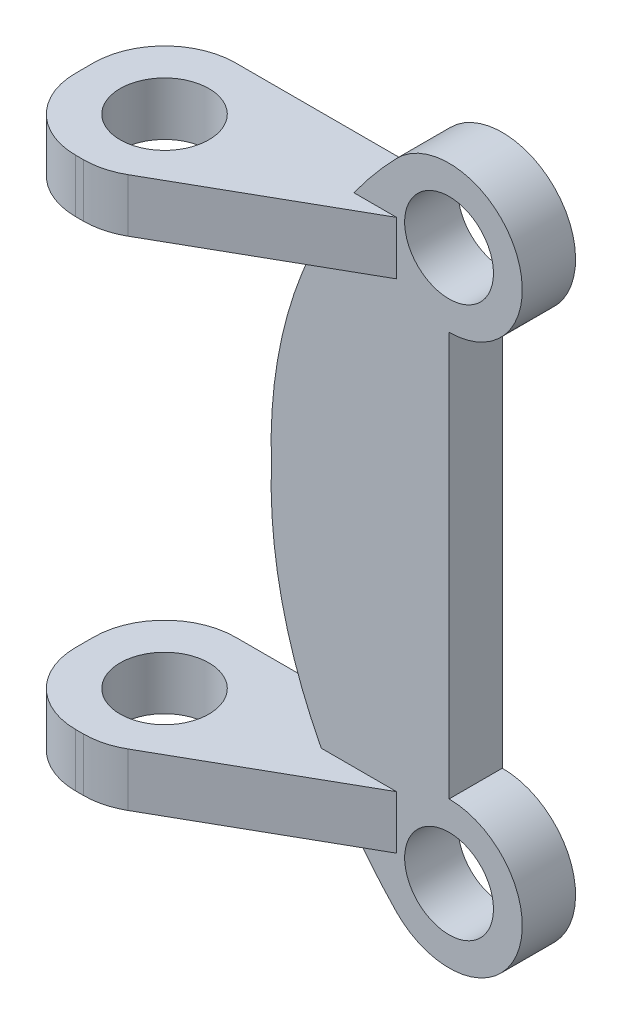
from build123d import *

# Parameters (mm, degrees)
CROQUIS2_R              = 2.5
SALIENTE_EXTRUIR1_DEPTH = 3
SALIENTE_EXTRUIR2_START = 12.5
CROQUIS4_R              = 2.5
SALIENTE_EXTRUIR2_DEPTH = 3


with BuildPart() as part:
    # Croquis2 → Saliente-Extruir1 (new body)
    with BuildSketch(Plane.XY):
        with BuildLine():
            Line((3.492952335, 10.790611409), (3.492952335, -11.964892683))
            ThreePointArc((3.492952335, -11.964892683), (7.2895288, -17.69304703), (0.534883591, -18.958160926))
            ThreePointArc((0.534883591, -18.958160926), (-4.86923602, -10.494496462), (-6.507047205, -0.587140637))
            ThreePointArc((-6.507047205, -0.587140637), (-4.86923602, 9.320215188), (0.534883591, 17.783879652))
            ThreePointArc((0.534883591, 17.783879652), (7.2895288, 16.518765755), (3.492952335, 10.790611409))
        make_face()
        with Locations((3.492952335, 14.912859363)):
            Circle(CROQUIS2_R, mode=Mode.SUBTRACT)
        with Locations((3.492952335, -16.087140637)):
            Circle(CROQUIS2_R, mode=Mode.SUBTRACT)
    extrude(amount=SALIENTE_EXTRUIR1_DEPTH)

    # Croquis4 → Saliente-Extruir2 (add)
    with BuildSketch(Plane(origin=(0, -0.587140637, 0), x_dir=(1, 0, 0), z_dir=(0, 1, 0)).offset(SALIENTE_EXTRUIR2_START)):
        with BuildLine():
            Line((0.534883591, -3), (-9.106451157, -8.477853714))
            ThreePointArc((-9.106451157, -8.477853714), (-10.060534072, -8.867260972), (-11.082440414, -9))
            Line((-11.082440414, -9), (-11.52545838, -9))
            ThreePointArc((-11.52545838, -9), (-14.353885504, -7.828427125), (-15.52545838, -5))
            Line((-15.52545838, -5), (-15.52545838, -4))
            ThreePointArc((-15.52545838, -4), (-14.353885504, -1.171572875), (-11.52545838, 0))
            Line((-11.52545838, 0), (0.534883591, 0))
            Line((0.534883591, 0), (0.534883591, -3))
        make_face()
        with Locations(Location((-11.02545838, -4.5, 0), (0, 0, 180))):
            Circle(CROQUIS4_R, mode=Mode.SUBTRACT)
    saliente_extruir2 = extrude(amount=SALIENTE_EXTRUIR2_DEPTH)

    # Simetría1: Saliente-Extruir2 across plane
    add(saliente_extruir2.mirror(Plane.ZX.offset(-0.587140637)))


solid = part.part
